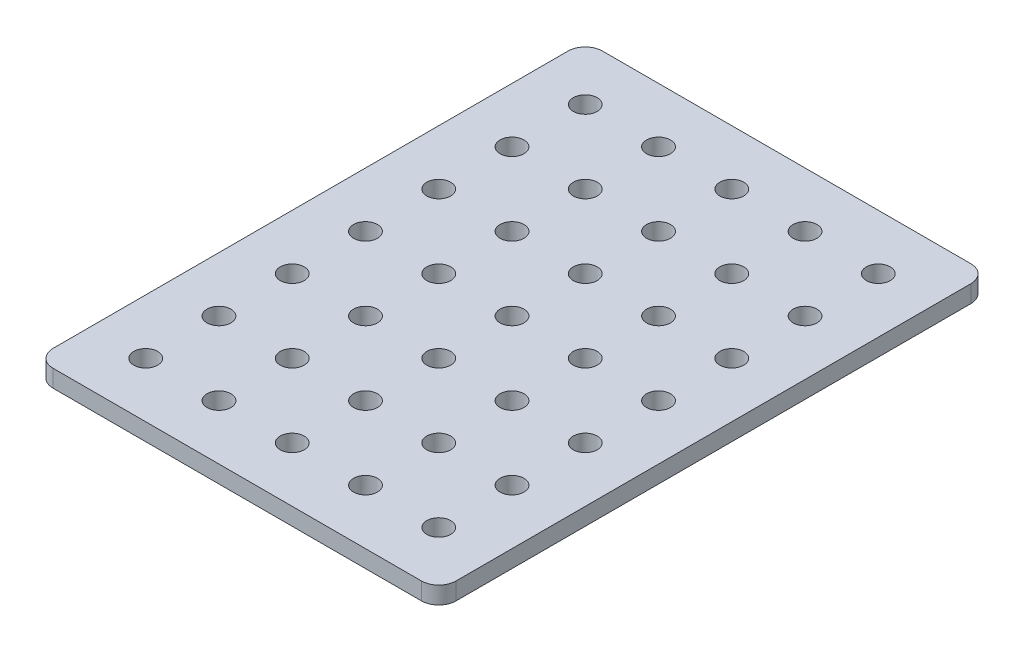
from build123d import *

# Parameters (mm, degrees)
SKETCH1_W           = 69.85
SKETCH1_H           = 95.25
SKETCH1_R           = 2.075
BOSS_EXTRUDE1_DEPTH = 1.5
FILLET1_R           = 3


with BuildPart() as part:
    # Sketch1 → Boss-Extrude1 (new, symmetric)
    with BuildSketch(Plane(origin=(0, 0, 0), x_dir=(1, 0, 0), z_dir=(0, 1, 0))):
        Rectangle(SKETCH1_W, SKETCH1_H)
        with Locations(Location((0, 0, 0), (0, 0, 270))):
            Circle(SKETCH1_R, mode=Mode.SUBTRACT)
        with Locations(Location((-25.4, 0, 0), (0, 0, 270))):
            Circle(SKETCH1_R, mode=Mode.SUBTRACT)
        with Locations(Location((-12.7, 0, 0), (0, 0, 270))):
            Circle(SKETCH1_R, mode=Mode.SUBTRACT)
        with Locations(Location((12.7, 0, 0), (0, 0, 270))):
            Circle(SKETCH1_R, mode=Mode.SUBTRACT)
        with Locations(Location((25.4, 0, 0), (0, 0, 270))):
            Circle(SKETCH1_R, mode=Mode.SUBTRACT)
        with Locations(Location((-25.4, 12.7, 0), (0, 0, 270))):
            Circle(SKETCH1_R, mode=Mode.SUBTRACT)
        with Locations(Location((-12.7, 12.7, 0), (0, 0, 270))):
            Circle(SKETCH1_R, mode=Mode.SUBTRACT)
        with Locations(Location((0, 12.7, 0), (0, 0, 270))):
            Circle(SKETCH1_R, mode=Mode.SUBTRACT)
        with Locations(Location((12.7, 12.7, 0), (0, 0, 270))):
            Circle(SKETCH1_R, mode=Mode.SUBTRACT)
        with Locations(Location((25.4, 12.7, 0), (0, 0, 270))):
            Circle(SKETCH1_R, mode=Mode.SUBTRACT)
        with Locations(Location((-25.4, 25.4, 0), (0, 0, 270))):
            Circle(SKETCH1_R, mode=Mode.SUBTRACT)
        with Locations(Location((-12.7, 25.4, 0), (0, 0, 270))):
            Circle(SKETCH1_R, mode=Mode.SUBTRACT)
        with Locations(Location((0, 25.4, 0), (0, 0, 270))):
            Circle(SKETCH1_R, mode=Mode.SUBTRACT)
        with Locations(Location((12.7, 25.4, 0), (0, 0, 270))):
            Circle(SKETCH1_R, mode=Mode.SUBTRACT)
        with Locations(Location((25.4, 25.4, 0), (0, 0, 270))):
            Circle(SKETCH1_R, mode=Mode.SUBTRACT)
        with Locations(Location((-25.4, 38.1, 0), (0, 0, 270))):
            Circle(SKETCH1_R, mode=Mode.SUBTRACT)
        with Locations(Location((-12.7, 38.1, 0), (0, 0, 270))):
            Circle(SKETCH1_R, mode=Mode.SUBTRACT)
        with Locations(Location((0, 38.1, 0), (0, 0, 270))):
            Circle(SKETCH1_R, mode=Mode.SUBTRACT)
        with Locations(Location((12.7, 38.1, 0), (0, 0, 270))):
            Circle(SKETCH1_R, mode=Mode.SUBTRACT)
        with Locations(Location((25.4, 38.1, 0), (0, 0, 270))):
            Circle(SKETCH1_R, mode=Mode.SUBTRACT)
        with Locations(Location((-25.4, -12.7, 0), (0, 0, 270))):
            Circle(SKETCH1_R, mode=Mode.SUBTRACT)
        with Locations(Location((-12.7, -12.7, 0), (0, 0, 270))):
            Circle(SKETCH1_R, mode=Mode.SUBTRACT)
        with Locations(Location((0, -12.7, 0), (0, 0, 270))):
            Circle(SKETCH1_R, mode=Mode.SUBTRACT)
        with Locations(Location((12.7, -12.7, 0), (0, 0, 270))):
            Circle(SKETCH1_R, mode=Mode.SUBTRACT)
        with Locations(Location((25.4, -12.7, 0), (0, 0, 270))):
            Circle(SKETCH1_R, mode=Mode.SUBTRACT)
        with Locations(Location((-25.4, -25.4, 0), (0, 0, 270))):
            Circle(SKETCH1_R, mode=Mode.SUBTRACT)
        with Locations(Location((-12.7, -25.4, 0), (0, 0, 270))):
            Circle(SKETCH1_R, mode=Mode.SUBTRACT)
        with Locations(Location((0, -25.4, 0), (0, 0, 270))):
            Circle(SKETCH1_R, mode=Mode.SUBTRACT)
        with Locations(Location((12.7, -25.4, 0), (0, 0, 270))):
            Circle(SKETCH1_R, mode=Mode.SUBTRACT)
        with Locations(Location((25.4, -25.4, 0), (0, 0, 270))):
            Circle(SKETCH1_R, mode=Mode.SUBTRACT)
        with Locations(Location((-25.4, -38.1, 0), (0, 0, 270))):
            Circle(SKETCH1_R, mode=Mode.SUBTRACT)
        with Locations(Location((-12.7, -38.1, 0), (0, 0, 270))):
            Circle(SKETCH1_R, mode=Mode.SUBTRACT)
        with Locations(Location((0, -38.1, 0), (0, 0, 270))):
            Circle(SKETCH1_R, mode=Mode.SUBTRACT)
        with Locations(Location((12.7, -38.1, 0), (0, 0, 270))):
            Circle(SKETCH1_R, mode=Mode.SUBTRACT)
        with Locations(Location((25.4, -38.1, 0), (0, 0, 270))):
            Circle(SKETCH1_R, mode=Mode.SUBTRACT)
    extrude(amount=BOSS_EXTRUDE1_DEPTH, both=True)

    # Fillet1
    fillet1_edges = [part.edges().sort_by_distance(p)[0] for p in [
        (34.925, 0, 47.625),
        (-34.925, 0, 47.625),
        (-34.925, 0, -47.625),
        (34.925, 0, -47.625),
    ]]
    fillet(fillet1_edges, radius=FILLET1_R)


solid = part.part
